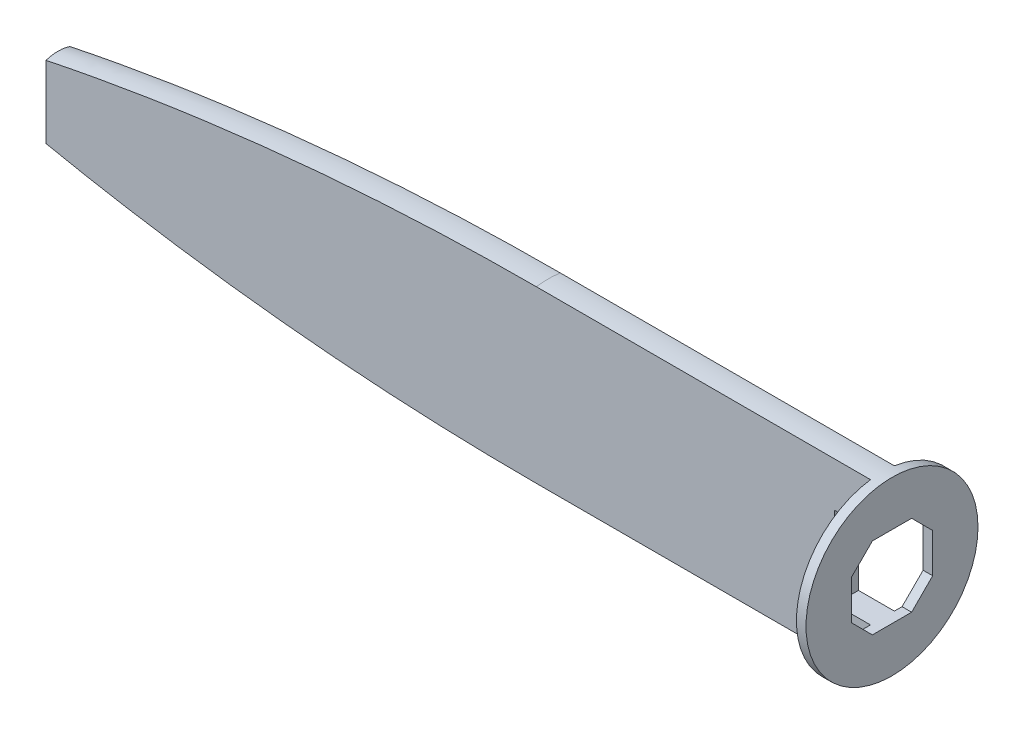
from build123d import *

# Parameters (mm, degrees)
CUT_EXTRUDE1_DEPTH  = 212.88306668
BOSS_EXTRUDE2_DEPTH = 139.7
SKETCH9_R           = 35.95202499
BOSS_EXTRUDE3_DEPTH = 4
CUT_EXTRUDE2_DEPTH  = 4
SKETCH11_W          = 10
SKETCH11_H          = 34
CUT_EXTRUDE3_DEPTH  = 15


with BuildPart() as part:
    # Sketch3 → Revolve1 (revolve)
    with BuildSketch(Plane.XY):
        with BuildLine():
            Line((285.74876522, 39.710021262), (285.74876522, 3.757996272))
            Line((285.74876522, 3.757996272), (80.74876522, 3.757996272))
            Line((80.74876522, 3.757996272), (80.74876522, 19.634316044))
            add(Edge.make_bspline(
                [(80.74876522, 19.634316044), (82.347112552, 19.950400666), (85.636412123, 20.593859316), (92.311794173, 21.870421625), (109.164486257, 24.943674568), (127.867996046, 27.977765645), (146.633052135, 30.604670801), (163.733801994, 32.658467989), (174.004488004, 33.801497199), (184.284802392, 34.855212792), (194.57611333, 35.797171826), (204.876878825, 36.627240946), (213.466527777, 37.244314669), (220.34120026, 37.693162367), (227.218898943, 38.097179671), (233.238636081, 38.411453209), (238.400481516, 38.652791264), (242.701722554, 38.8352093), (246.145182192, 38.969923968), (249.584994627, 39.093417446), (253.03241088, 39.20568842), (256.467961578, 39.306735697), (259.924132141, 39.396558203), (263.346991762, 39.475154984), (266.82565511, 39.542525204), (270.211898057, 39.598668148), (273.756466178, 39.643583219), (276.60509147, 39.673059099), (279.43950326, 39.691306197), (281.597603414, 39.703938851), (283.942998009, 39.708617629), (285.03032454, 39.710021262), (285.74876522, 39.710021262)],
                knots=[0.322773044, 0.322773044, 0.322773044, 0.322773044, 0.322773044, 0.341563488, 0.3614269, 0.401153715, 0.520334158, 0.56006097, 0.579924379, 0.599787787, 0.639514601, 0.679241414, 0.699104823, 0.718968231, 0.738831638, 0.758695045, 0.778558452, 0.788490156, 0.798421859, 0.808353563, 0.818285267, 0.828216971, 0.838148675, 0.848080378, 0.858012082, 0.867943786, 0.87787549, 0.887807193, 0.897738897, 0.902704749, 0.9076706, 0.917602304, 0.917602304, 0.917602304, 0.917602304, 0.917602304], degree=4))
        make_face()
    revolve(axis=Axis((285.74876522, 3.757996272, 0), (-1, 0, 0)))

    # Sketch6 → Cut-Extrude1 (cut, through all)
    with BuildSketch(Plane(origin=(285.74876522, 0, 0), x_dir=(0, 0, -1), z_dir=(1, 0, 0))):
        with BuildLine():
            Line((-5, -31.844645496), (-5, 39.36063804))
            ThreePointArc((-5, 39.360638041), (-35.95202499, 3.757996272), (-5, -31.844645496))
        make_face()
        with BuildLine():
            ThreePointArc((35.95202499, 3.757996272), (27.132160123, 27.346001444), (5, 39.36063804))
            Line((5, 39.36063804), (5, -31.844645496))
            ThreePointArc((5, -31.844645496), (27.132160123, -19.830008899), (35.95202499, 3.757996272))
        make_face()
    extrude(amount=-CUT_EXTRUDE1_DEPTH, mode=Mode.SUBTRACT)

    # Sketch8 → Boss-Extrude2 (add)
    with BuildSketch(Plane(origin=(285.74876522, 0, 0), x_dir=(0, 0, -1), z_dir=(1, 0, 0))):
        with BuildLine():
            Line((5, -31.844645496), (5, 39.360638041))
            ThreePointArc((5, 39.360638041), (0, 39.710021262), (-5, 39.360638041))
            Line((-5, 39.360638041), (-5, -31.844645496))
            ThreePointArc((-5, -31.844645496), (0, -32.194028718), (5, -31.844645496))
        make_face()
    extrude(amount=BOSS_EXTRUDE2_DEPTH)

    # Sketch9 → Boss-Extrude3 (add)
    with BuildSketch(Plane(origin=(425.44876522, 0, 0), x_dir=(0, 0, -1), z_dir=(1, 0, 0))):
        with Locations(Location((0, 3.757996272, 0), (0, 0, 262.00572083))):
            Circle(SKETCH9_R)
    extrude(amount=BOSS_EXTRUDE3_DEPTH)

    # Sketch10 → Cut-Extrude2 (cut)
    with BuildSketch(Plane(origin=(429.44876522, 0, 0), x_dir=(0, 0, -1), z_dir=(1, 0, 0))):
        Polygon((-17, -4.442003728), (-17, 11.957996272), (-8.2, 20.757996272), (8.2, 20.757996272), (17, 11.957996272), (17, -4.442003728), (8.2, -13.242003728), (-8.2, -13.242003728), align=None)
    extrude(amount=-CUT_EXTRUDE2_DEPTH, mode=Mode.SUBTRACT)

    # Sketch11 → Cut-Extrude3 (cut)
    with BuildSketch(Plane(origin=(425.44876522, 0, 0), x_dir=(0, 0, -1), z_dir=(1, 0, 0))):
        with Locations((0, 3.757996272)):
            Rectangle(SKETCH11_W, SKETCH11_H)
    extrude(amount=-CUT_EXTRUDE3_DEPTH, mode=Mode.SUBTRACT)


solid = part.part
